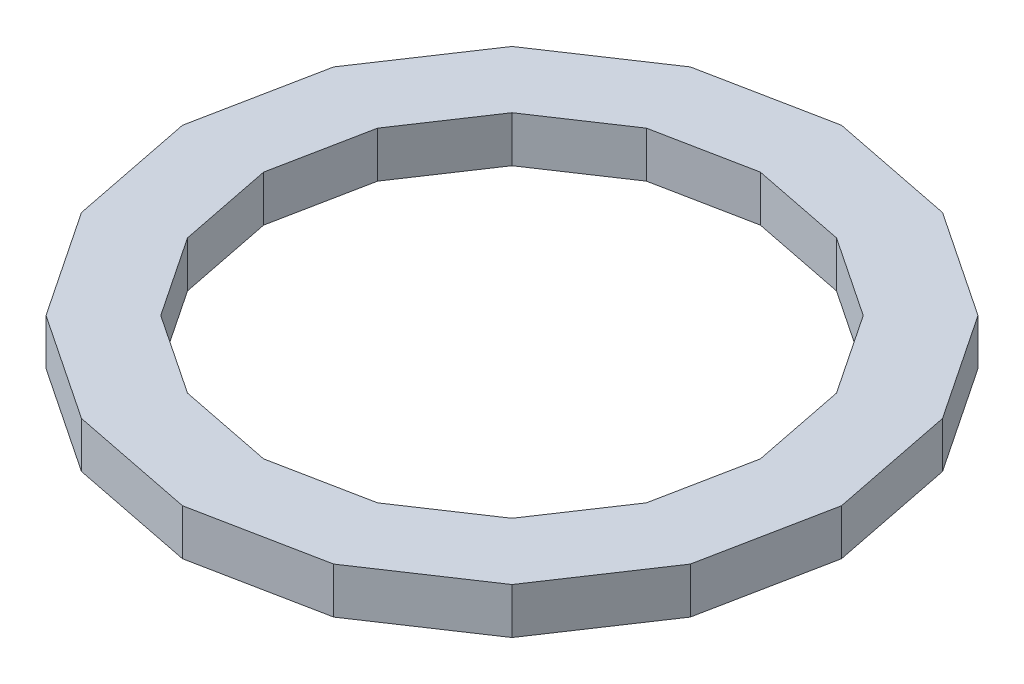
from build123d import *

# Parameters (mm, degrees)
BOSS_EXTRUDE1_DEPTH = 19.05


with BuildPart() as part:
    # Sketch1 → Boss-Extrude1 (new body)
    with BuildSketch(Plane(origin=(0, 0, 0), x_dir=(1, 0, 0), z_dir=(0, 1, 0))):
        Polygon((136.705909983, 0), (126.299792206, 52.315086857), (96.665675977, 96.665675977), (52.315086857, 126.299792206), (0, 136.705909983), (-52.315086857, 126.299792206), (-96.665675977, 96.665675977), (-126.299792206, 52.315086857), (-136.705909983, 0), (-126.299792206, -52.315086857), (-96.665675977, -96.665675977), (-52.315086857, -126.299792206), (0, -136.705909983), (52.315086857, -126.299792206), (96.665675977, -96.665675977), (126.299792206, -52.315086857), align=None)
        Polygon((103.039009938, 0), (95.195632332, 39.431321991), (72.859582654, 72.859582654), (39.431321991, 95.195632332), (0, 103.039009938), (-39.431321991, 95.195632332), (-72.859582654, 72.859582654), (-95.195632332, 39.431321991), (-103.039009938, 0), (-95.195632332, -39.431321991), (-72.859582654, -72.859582654), (-39.431321991, -95.195632332), (0, -103.039009938), (39.431321991, -95.195632332), (72.859582654, -72.859582654), (95.195632332, -39.431321991), align=None, mode=Mode.SUBTRACT)
    extrude(amount=BOSS_EXTRUDE1_DEPTH)


solid = part.part
